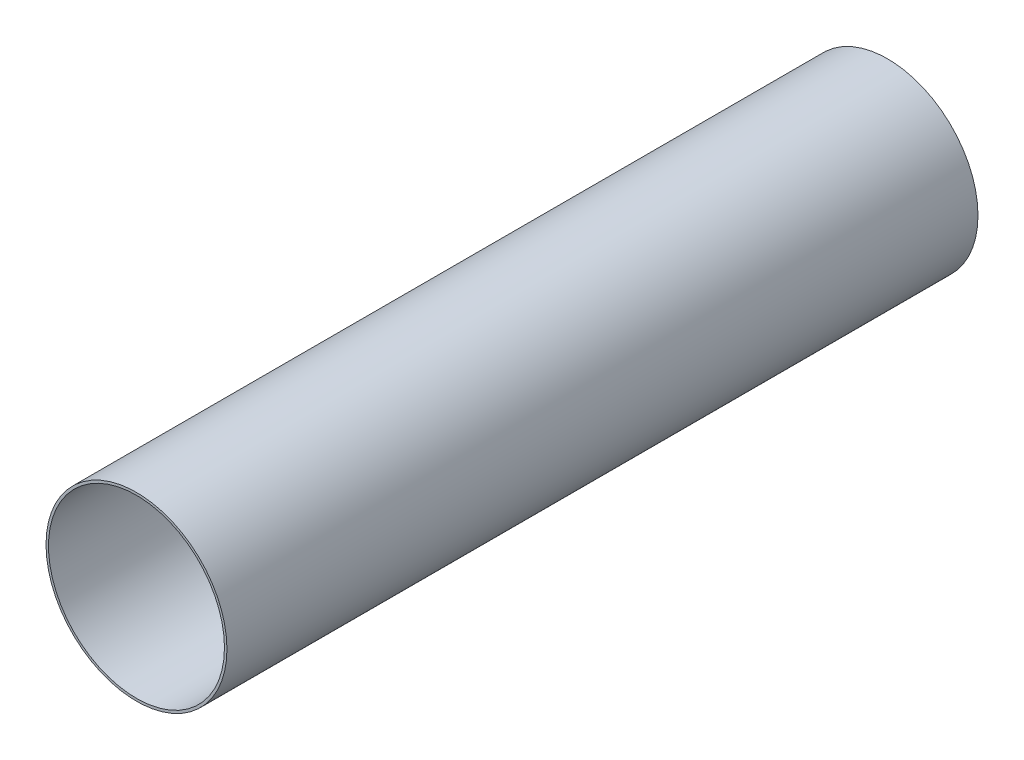
from build123d import *

# Parameters (mm, degrees)
SKETCH1_R           = 73
SKETCH1_R_2         = 71
BOSS_EXTRUDE1_DEPTH = 604
BOSS_EXTRUDE2_START = 2
SKETCH2_R           = 73
BOSS_EXTRUDE2_DEPTH = 2


with BuildPart() as part:
    # Sketch1 → Boss-Extrude1 (new body)
    with BuildSketch(Plane.XY):
        Circle(SKETCH1_R)
        Circle(SKETCH1_R_2, mode=Mode.SUBTRACT)
    extrude(amount=BOSS_EXTRUDE1_DEPTH)

    # Sketch2 → Boss-Extrude2 (add)
    with BuildSketch(Plane(origin=(0, 0, 0), x_dir=(-1, 0, 0), z_dir=(0, 0, -1)).offset(BOSS_EXTRUDE2_START)):
        Circle(SKETCH2_R)
    extrude(amount=-BOSS_EXTRUDE2_DEPTH)


solid = part.part
